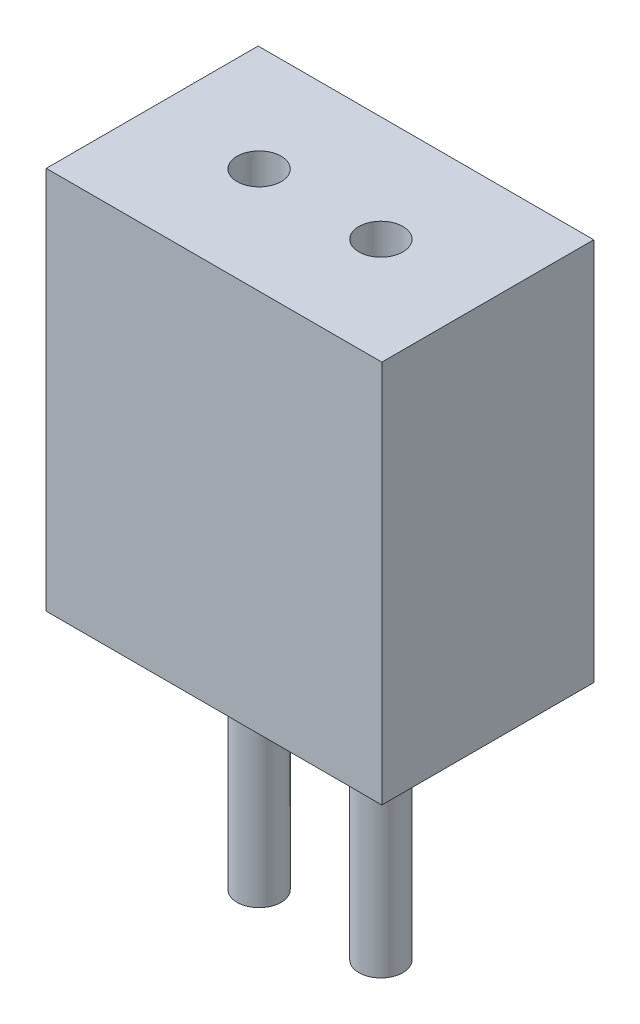
from build123d import *

# Parameters (mm, degrees)
SKETCH1_W           = 3.5
SKETCH1_H           = 2.21
BOSS_EXTRUDE1_DEPTH = 4
SKETCH2_R           = 0.23
BOSS_EXTRUDE2_DEPTH = 2.51
SKETCH3_R           = 0.23
CUT_EXTRUDE1_DEPTH  = 2.51


with BuildPart() as part:
    # Sketch1 → Boss-Extrude1 (new body)
    with BuildSketch(Plane(origin=(0, 0, 0), x_dir=(1, 0, 0), z_dir=(0, 1, 0))):
        with Locations((1.75, 1.105)):
            Rectangle(SKETCH1_W, SKETCH1_H)
    extrude(amount=BOSS_EXTRUDE1_DEPTH)

    # Sketch2 → Boss-Extrude2 (add)
    with BuildSketch(Plane.XZ):
        with Locations(Location((1.115, -1.105, 0), (0, 0, 270))):
            Circle(SKETCH2_R)
        with Locations(Location((2.385, -1.105, 0), (0, 0, 270))):
            Circle(SKETCH2_R)
    extrude(amount=BOSS_EXTRUDE2_DEPTH)

    # Sketch3 → Cut-Extrude1 (cut)
    with BuildSketch(Plane(origin=(0, 4, 0), x_dir=(1, 0, 0), z_dir=(0, 1, 0))):
        with Locations(Location((2.385, 1.105, 0), (0, 0, 90))):
            Circle(SKETCH3_R)
        with Locations(Location((1.115, 1.105, 0), (0, 0, 90))):
            Circle(SKETCH3_R)
    extrude(amount=-CUT_EXTRUDE1_DEPTH, mode=Mode.SUBTRACT)


solid = part.part
